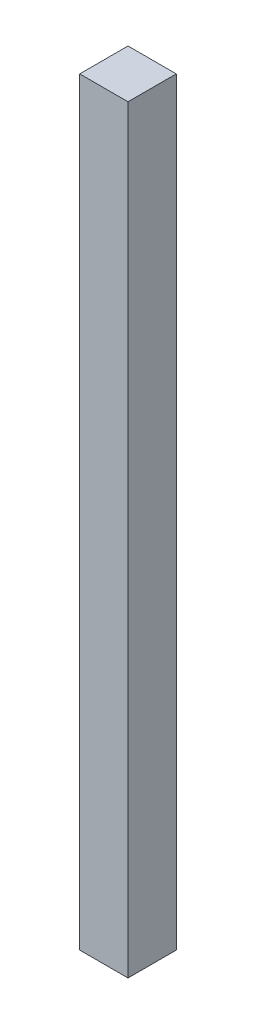
from build123d import *

# Parameters (mm, degrees)
SKETCH1_W           = 25.4
SKETCH1_H           = 25.4
BOSS_EXTRUDE1_DEPTH = 399.2


with BuildPart() as part:
    # Sketch1 → Boss-Extrude1 (new body)
    with BuildSketch(Plane(origin=(0, 0, 0), x_dir=(1, 0, 0), z_dir=(0, 1, 0))):
        with Locations((12.7, 12.7)):
            Rectangle(SKETCH1_W, SKETCH1_H)
    extrude(amount=BOSS_EXTRUDE1_DEPTH)


solid = part.part
